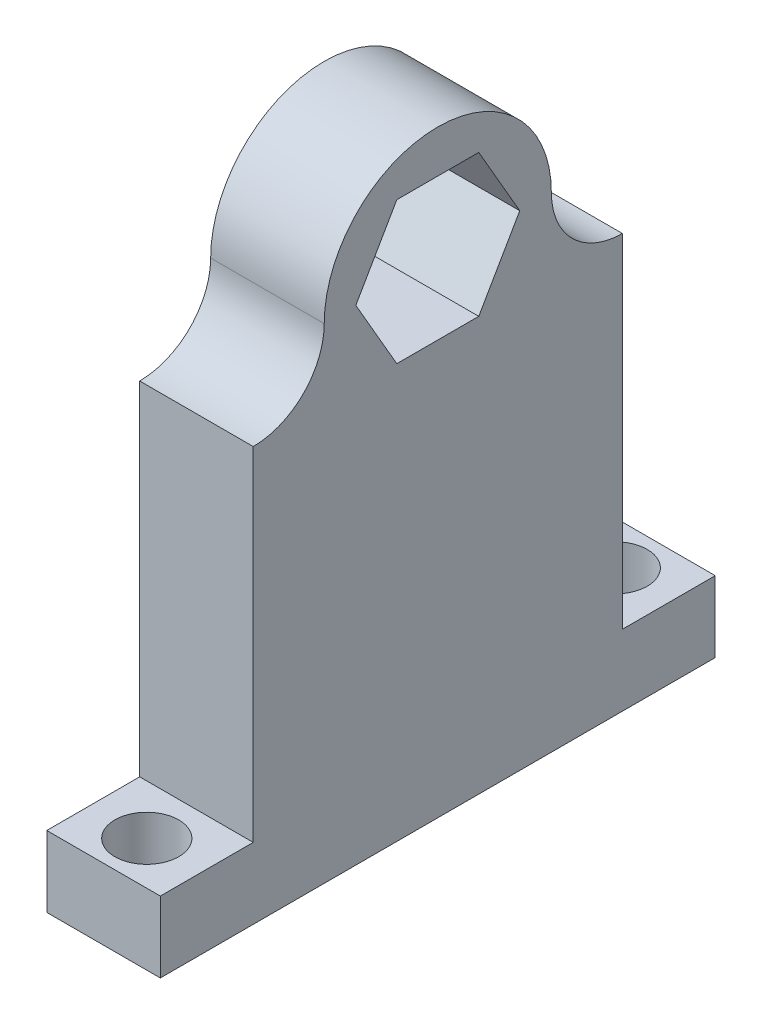
from build123d import *

# Parameters (mm, degrees)
EXTRUDE_1_DEPTH     = 8
CUT_EXTRUDE_1_DEPTH = 19.248287591
SKETCH_4_W          = 8
SKETCH_4_H          = 26
EXTRUDE_2_DEPTH     = 24.15
SKETCH_5_W          = 8
SKETCH_5_H          = 39.090909091
SKETCH_5_R          = 2.25
EXTRUDE_3_DEPTH     = 5


with BuildPart() as part:
    # Эскиз1 → Бобышка-Вытянуть1 (new body)
    with BuildSketch(Plane(origin=(0, 0, 0), x_dir=(0, 0, -1), z_dir=(1, 0, 0))):
        with BuildLine():
            Line((-13, -5), (-13, -10))
            Line((-13, -10), (13, -10))
            Line((13, -10), (13, -5))
            ThreePointArc((13, -5), (9.464466094, -3.535533906), (8, 0))
            ThreePointArc((8, 0), (0, 8), (-8, 0))
            ThreePointArc((-8, 0), (-9.464466094, -3.535533906), (-13, -5))
        make_face()
    extrude(amount=EXTRUDE_1_DEPTH)

    # Эскиз2 → Вырез-Вытянуть1 (cut, through all)
    with BuildSketch(Plane(origin=(8, 0, 0), x_dir=(0, 0, -1), z_dir=(1, 0, 0))):
        Polygon((5.773502692, 0), (2.886751346, 5), (-2.886751346, 5), (-5.773502692, 0), (-2.886751346, -5), (2.886751346, -5), align=None)
    extrude(amount=-CUT_EXTRUDE_1_DEPTH, mode=Mode.SUBTRACT)

    # Эскиз4 → Бобышка-Вытянуть2 (add)
    with BuildSketch(Plane.XZ.offset(10)):
        with Locations((4, 0)):
            Rectangle(SKETCH_4_W, SKETCH_4_H)
    extrude(amount=EXTRUDE_2_DEPTH)

    # Эскиз5 → Бобышка-Вытянуть3 (add)
    with BuildSketch(Plane.XZ.offset(34.15)):
        with Locations((4, -1e-09)):
            Rectangle(SKETCH_5_W, SKETCH_5_H)
        with Locations(Location((4, -16.5, 0), (0, 0, 270))):
            Circle(SKETCH_5_R, mode=Mode.SUBTRACT)
        with Locations(Location((4, 16.5, 0), (0, 0, 270))):
            Circle(SKETCH_5_R, mode=Mode.SUBTRACT)
    extrude(amount=-EXTRUDE_3_DEPTH)


solid = part.part
